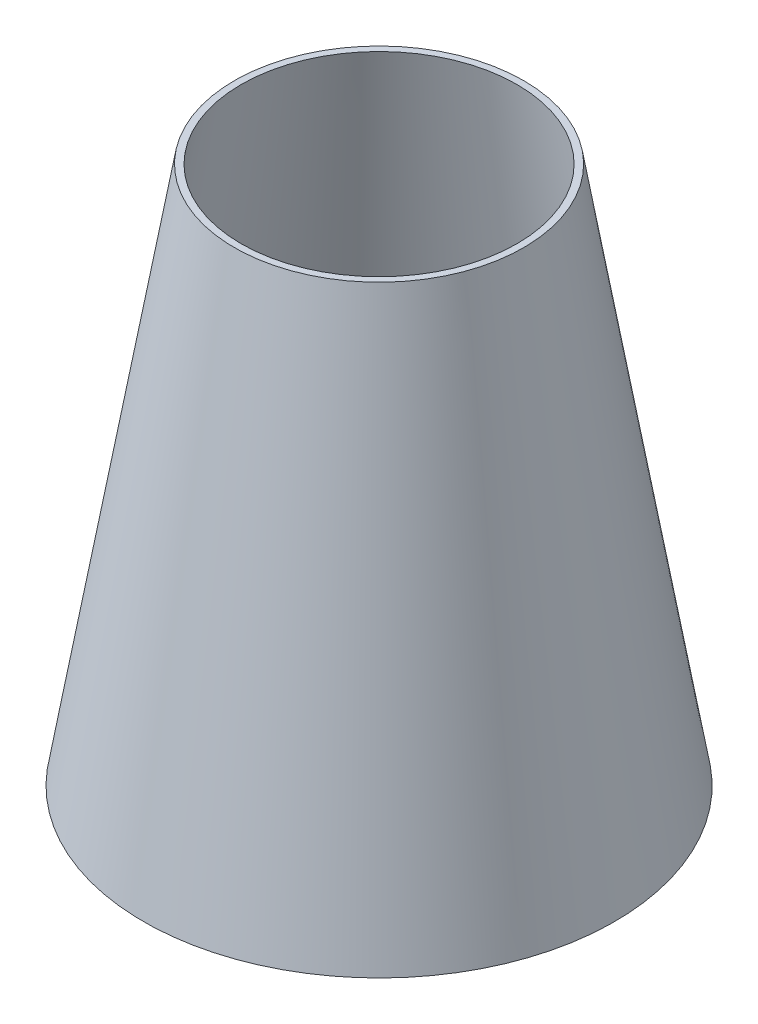
from build123d import *


with BuildPart() as part:
    # Esboço1 → Revolução1 (revolve)
    with BuildSketch(Plane.XY, mode=Mode.PRIVATE) as revolu_o1_sk:
        Polygon((-35, 0), (-21.5, 80), (-20.5, 80), (-34, 0), align=None)
    revolve(revolu_o1_sk.sketch.rotate(Axis((0, 0, 0), (0, 1, 0)), 270), axis=Axis((0, 0, 0), (0, 1, 0)))


solid = part.part
